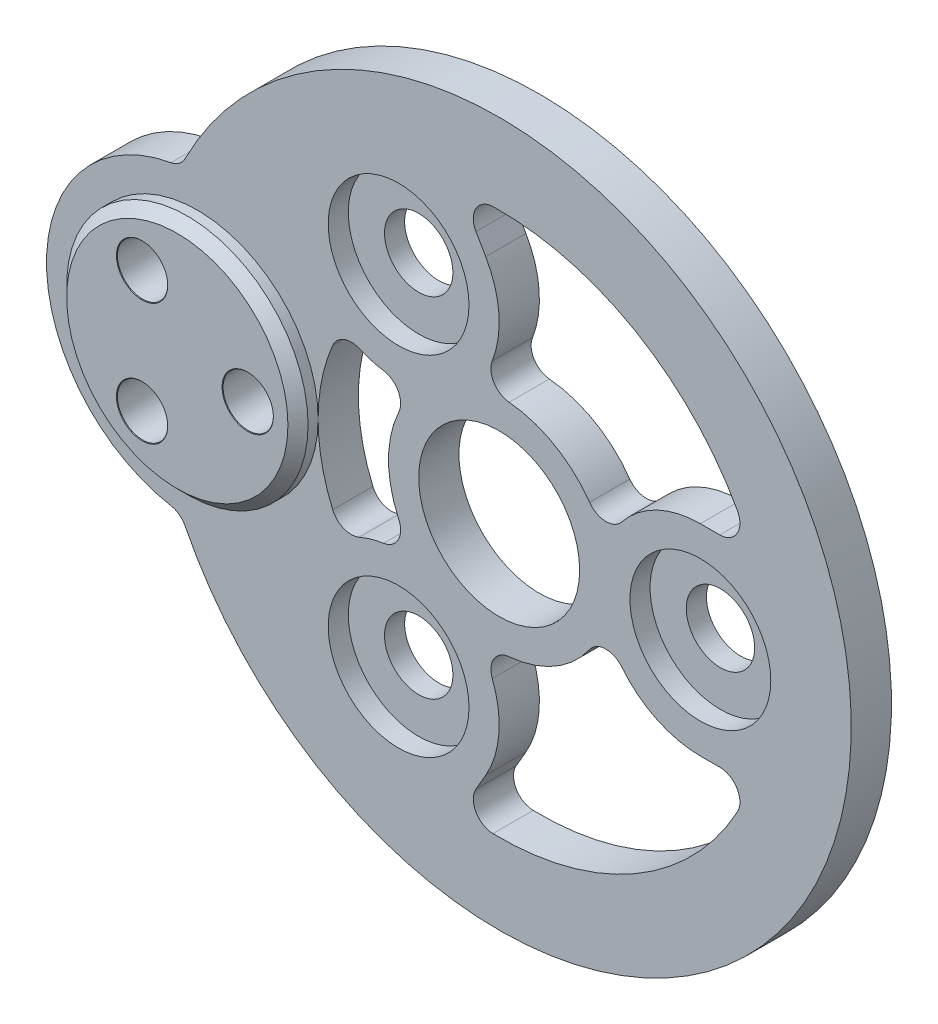
from build123d import *

# Parameters (mm, degrees)
SKETCH_1_R               = 4
EXTRUDE_1_DEPTH          = 2
SKETCH_6_R               = 6
EXTRUDE_3_DEPTH          = 1
SKETCH_2_R               = 0.5
CUT_EXTRUDE_1_DEPTH      = 2
PATTERN_CIRCULAR_1_COUNT = 3
CHAMFER_1_SIZE           = 0.5
EXTRUDE_START            = -2
EXTRUDE_4_DEPTH          = 2
HOLE_WIZARD_M3_1_D       = 3.4
SKETCH_11_R              = 3.5
CUT_EXTRUDE_3_DEPTH      = 1
CUT_EXTRUDE_4_DEPTH      = 29.574464124
FILLET_1_R               = 1
FILLET_2_R               = 1


with BuildPart() as part:
    # ｽｹｯﾁ1 → ﾎﾞｽ - 押し出し1 (new body)
    with BuildSketch(Plane.XY):
        with BuildLine():
            ThreePointArc((-4.5, -6), (7.5, 0), (-4.5, 6))
            ThreePointArc((-4.5, 6), (-7.5, 5), (-10.5, 6))
            ThreePointArc((-10.5, 6), (-22.5, 0), (-10.5, -6))
            ThreePointArc((-10.5, -6), (-7.5, -5), (-4.5, -6))
        make_face()
        Circle(SKETCH_1_R, mode=Mode.SUBTRACT)
    extrude(amount=EXTRUDE_1_DEPTH)

    # ｽｹｯﾁ6 → ﾎﾞｽ - 押し出し3 (add)
    with BuildSketch(Plane.XY.offset(2)):
        with Locations((-15, 0)):
            Circle(SKETCH_6_R)
    extrude(amount=EXTRUDE_3_DEPTH)

    # ｽｹｯﾁ2 → ｶｯﾄ - 押し出し1 (cut)
    with BuildSketch(Plane.XY.offset(3)):
        with Locations((-11.5, 0)):
            Circle(SKETCH_2_R)
    extrude(amount=-CUT_EXTRUDE_1_DEPTH, mode=Mode.SUBTRACT)

    # ｽｹｯﾁ4 → M3x0.5 ねじ穴1 (revolve, cut)
    with BuildSketch(Plane(origin=(-11.5, 0, 3), x_dir=(0, -1, 0), z_dir=(1, 0, 0))):
        Polygon((0, 0), (0, 3), (1.525, 3), (1.25, 2.725), (1.25, 0.025), (1.275, 0), align=None)
    m3x0_5_1 = revolve(axis=Axis((-11.5, 0, 9.35), (0, 0, -1)), mode=Mode.SUBTRACT)

    # 円形ﾊﾟﾀｰﾝ1: M3x0.5 ねじ穴1 ×3 about axis
    pattern_circular_1_axis = Axis((-15, 0, 0), (0, 0, 1))
    for i in range(1, PATTERN_CIRCULAR_1_COUNT):
        add(m3x0_5_1.rotate(pattern_circular_1_axis, i * 360 / PATTERN_CIRCULAR_1_COUNT), mode=Mode.SUBTRACT)

    # 面取り1
    chamfer_1_edges = [part.edges().sort_by_distance(p)[0] for p in [
        (-21, 0, 3),
    ]]
    chamfer(chamfer_1_edges, length=CHAMFER_1_SIZE)

    # ｽｹｯﾁ7 → ﾎﾞｽ - 押し出し4 (add)
    with BuildSketch(Plane.XY.offset(2).offset(EXTRUDE_START)):
        with BuildLine():
            ThreePointArc((-15.833333333, -7.453559925), (3.818813079, -17.078251277), (17.5, 0))
            ThreePointArc((17.5, 0), (3.818813079, 17.078251277), (-15.833333333, 7.453559925))
            ThreePointArc((-15.833333333, 7.453559925), (-13.027864045, 7.236067977), (-10.5, 6))
            ThreePointArc((-10.5, 6), (-7.5, 5), (-4.5, 6))
            ThreePointArc((-4.5, 6), (7.5, 0), (-4.5, -6))
            ThreePointArc((-4.5, -6), (-7.5, -5), (-10.5, -6))
            ThreePointArc((-10.5, -6), (-13.027864045, -7.236067977), (-15.833333333, -7.453559925))
        make_face()
    extrude(amount=EXTRUDE_4_DEPTH)

    # M3 すきま穴1 (through all)
    with Locations(Plane.XY.offset(2)):
        with Locations((-5, 8.660254038), (-5, -8.660254038), (10, 0)):
            Hole(HOLE_WIZARD_M3_1_D / 2)

    # ｽｹｯﾁ11 → ｶｯﾄ - 押し出し3 (cut)
    with BuildSketch(Plane.XY.offset(2)):
        with Locations((-5, 8.660254038)):
            Circle(SKETCH_11_R)
        with Locations((10, 0)):
            Circle(SKETCH_11_R)
        with Locations((-5, -8.660254038)):
            Circle(SKETCH_11_R)
    extrude(amount=-CUT_EXTRUDE_3_DEPTH, mode=Mode.SUBTRACT)

    # ｽｹｯﾁ12 → ｶｯﾄ - 押し出し4 (cut, through all)
    with BuildSketch(Plane.XY.offset(2)):
        with BuildLine():
            ThreePointArc((6.09375, 3.121091306), (7.83268098, 4.505854887), (10, 5))
            Line((10, 5), (12.539936204, 5))
            ThreePointArc((12.539936204, 5), (6.75, 11.691342951), (-1.939841083, 13.359903314))
            Line((-1.939841083, 13.359903314), (-0.669872981, 11.160254038))
            ThreePointArc((-0.669872981, 11.160254038), (-0.014155692, 9.036228152), (-0.343930642, 6.837887957))
            ThreePointArc((-0.343930642, 6.837887957), (-0.263339736, 5.947638581), (0.496931964, 5.477504781))
            ThreePointArc((0.496931964, 5.477504781), (2.75, 4.763139721), (4.495192308, 3.169108095))
            ThreePointArc((4.495192308, 3.169108095), (5.282475971, 2.745760389), (6.09375, 3.121091306))
        make_face()
        with BuildLine():
            ThreePointArc((-1.939841083, -13.359903314), (6.75, -11.691342951), (12.539936204, -5))
            Line((12.539936204, -5), (10, -5))
            ThreePointArc((10, -5), (7.83268098, -4.505854887), (6.09375, -3.121091306))
            ThreePointArc((6.09375, -3.121091306), (5.282475971, -2.745760389), (4.495192308, -3.169108095))
            ThreePointArc((4.495192308, -3.169108095), (2.75, -4.763139721), (0.496931964, -5.477504781))
            ThreePointArc((0.496931964, -5.477504781), (-0.263339736, -5.947638581), (-0.343930642, -6.837887957))
            ThreePointArc((-0.343930642, -6.837887957), (-0.014155692, -9.036228152), (-0.669872981, -11.160254038))
            Line((-0.669872981, -11.160254038), (-1.939841083, -13.359903314))
        make_face()
        with BuildLine():
            ThreePointArc((-5.749819358, 3.716796652), (-6.813042195, 4.000546107), (-7.788444419, 4.510003717))
            ThreePointArc((-7.788444419, 4.510003717), (-9, 0), (-7.788444419, -4.510003717))
            ThreePointArc((-7.788444419, -4.510003717), (-6.813042195, -4.000546107), (-5.749819358, -3.716796652))
            ThreePointArc((-5.749819358, -3.716796652), (-5.019136236, -3.201878191), (-4.992124271, -2.308396686))
            ThreePointArc((-4.992124271, -2.308396686), (-5.5, 0), (-4.992124271, 2.308396686))
            ThreePointArc((-4.992124271, 2.308396686), (-5.019136236, 3.201878191), (-5.749819358, 3.716796652))
        make_face()
    extrude(amount=-CUT_EXTRUDE_4_DEPTH, mode=Mode.SUBTRACT)

    # ﾌｨﾚｯﾄ1
    fillet_1_edges = [part.edges().sort_by_distance(p)[0] for p in [
        (-1.939841083, 13.359903314, 1),
        (12.539936204, 5, 1),
        (12.539936204, -5, 1),
        (-1.939841083, -13.359903314, 1),
        (-7.788444419, 4.510003717, 1),
        (-7.788444419, -4.510003717, 1),
    ]]
    fillet(fillet_1_edges, radius=FILLET_1_R)

    # ﾌｨﾚｯﾄ2
    fillet_2_edges = [part.edges().sort_by_distance(p)[0] for p in [
        (-15.833333333, 7.453559925, 1),
        (-15.833333333, -7.453559925, 1),
    ]]
    fillet(fillet_2_edges, radius=FILLET_2_R)


solid = part.part
